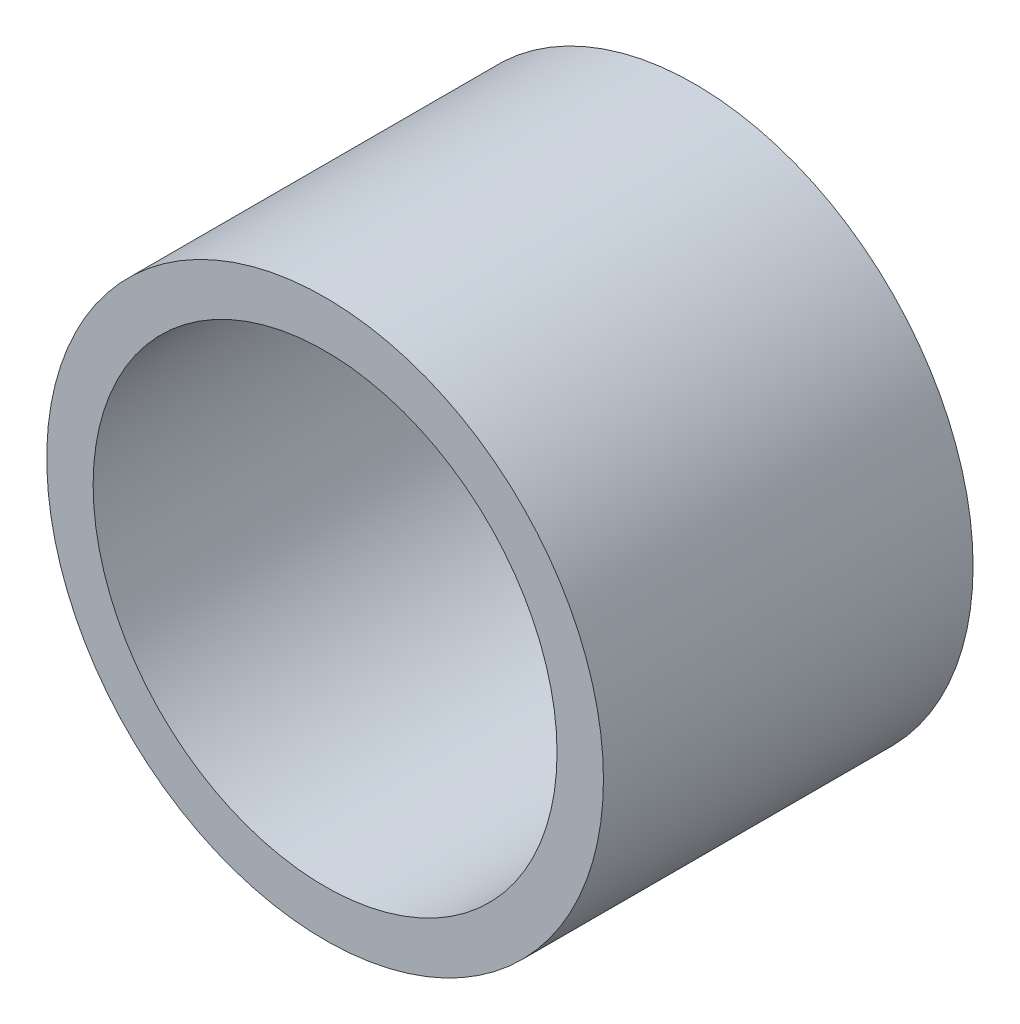
from build123d import *

# Parameters (mm, degrees)
SKETCH1_R           = 9.525
SKETCH1_R_2         = 7.9375
BOSS_EXTRUDE1_DEPTH = 12.6492


with BuildPart() as part:
    # Sketch1 → Boss-Extrude1 (new body)
    with BuildSketch(Plane.XY):
        Circle(SKETCH1_R)
        Circle(SKETCH1_R_2, mode=Mode.SUBTRACT)
    extrude(amount=BOSS_EXTRUDE1_DEPTH)


solid = part.part
